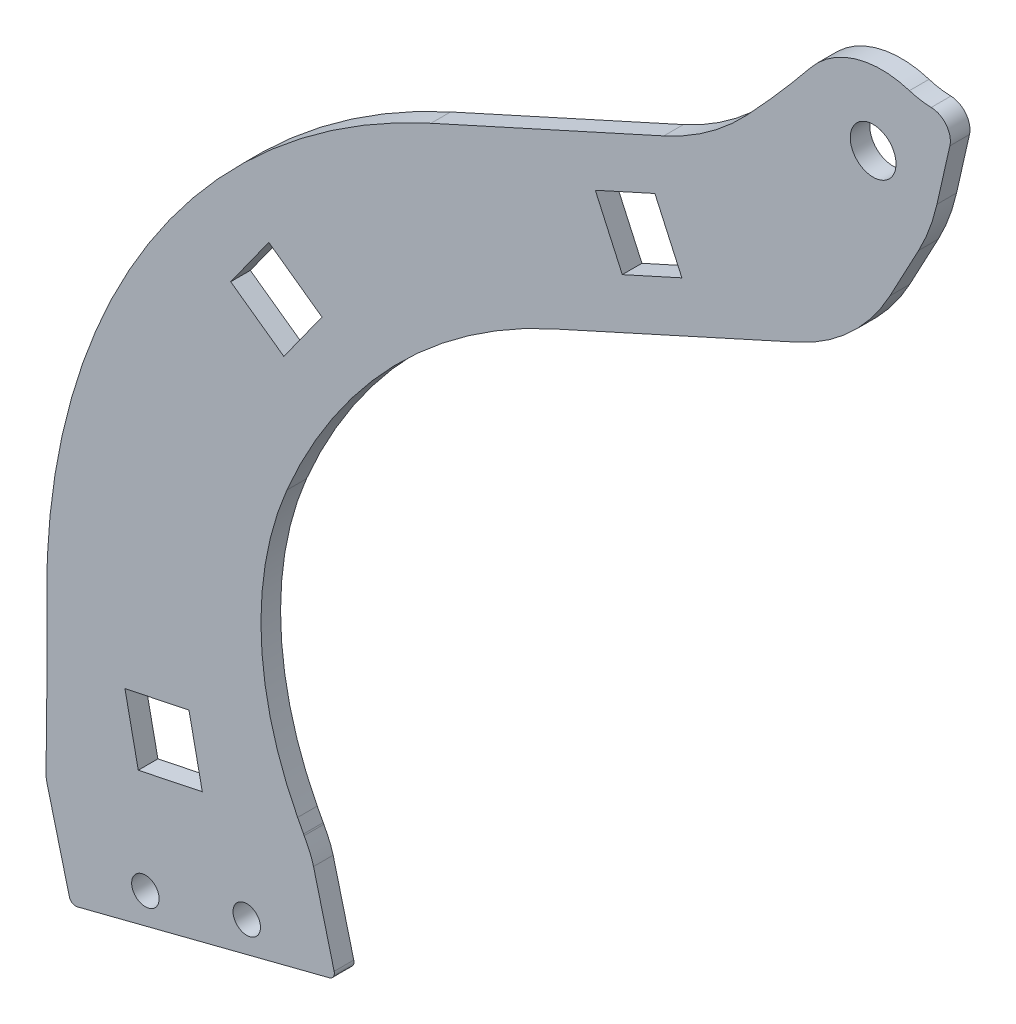
from build123d import *

# Parameters (mm, degrees)
SKETCH_1_R      = 2.1
SKETCH_1_R_2    = 3.5
EXTRUDE_2_DEPTH = 3


with BuildPart() as part:
    # 草图1 → 凸台-拉伸2 (new body)
    with BuildSketch(Plane.XY):
        with BuildLine():
            Line((60.108529062, 56.480111122), (64.487335669, 64.669737676))
            ThreePointArc((64.487335669, 64.669737676), (66.140949497, 68.333634007), (67.289887488, 72.185713512))
            Line((67.289887488, 72.185713512), (69.266744251, 80.910498231))
            ThreePointArc((69.266744251, 80.910498231), (68.708488356, 83.415866549), (66.417026795, 84.572466723))
            ThreePointArc((66.417026795, 84.572466723), (64.732022053, 84.734670443), (63.08660729, 85.132365403))
            ThreePointArc((63.08660729, 85.132365403), (54.829995833, 85.201744676), (47.970271321, 80.606026467))
            ThreePointArc((47.970271321, 80.606026467), (43.361470665, 75.124097666), (38.559351744, 69.810695675))
            Line((38.559351744, 69.810695675), (38.222405654, 69.45103511))
            ThreePointArc((38.222405654, 69.45103511), (32.32628292, 64.281621274), (25.53494992, 60.361812759))
            Line((25.53494992, 60.361812759), (-10.053418577, 44.242472458))
            ThreePointArc((-10.053418577, 44.242472458), (-53.239902616, 6.713533173), (-68.783230916, -48.349145956))
            ThreePointArc((-68.783230916, -48.349145956), (-68.739018938, -53.556339201), (-68.762598868, -58.763666747))
            Line((-68.762598868, -58.763666747), (-68.900791413, -71.283477095))
            add(Edge.make_bspline(
                [(-68.900791413, -71.283477095), (-68.904755434, -71.642604913), (-68.869353076, -71.99725933), (-68.78007525, -72.345791606)],
                knots=[0, 0, 0, 0, 1, 1, 1, 1], degree=3))
            Line((-68.78007525, -72.345791606), (-65.332232289, -85.805847824))
            add(Edge.make_bspline(
                [(-65.332232289, -85.805847824), (-65.266290033, -86.063280218), (-65.094030982, -86.28740051), (-64.753434981, -86.484972432), (-64.626638003, -86.528436786), (-64.365301889, -86.564062669), (-64.232742572, -86.556495641), (-64.104070986, -86.52353594)],
                knots=[0, 0, 0, 0, 0.5, 0.5, 0.75, 0.75, 1, 1, 1, 1], degree=3))
            Line((-64.104070986, -86.52353594), (-25.588649762, -76.657668977))
            add(Edge.make_bspline(
                [(-25.588649762, -76.657668977), (-25.460001904, -76.624715354), (-25.338581913, -76.566631903), (-25.128149885, -76.410642035), (-25.037269873, -76.310980591), (-24.901787172, -76.086443416), (-24.85605053, -75.960103889), (-24.81724118, -75.699526051), (-24.823808393, -75.566599434), (-24.856772712, -75.437909819)],
                knots=[0, 0, 0, 0, 0.25, 0.25, 0.5, 0.5, 0.75, 0.75, 1, 1, 1, 1], degree=3))
            Line((-24.856772712, -75.437909819), (-28.008350918, -63.134443476))
            add(Edge.make_bspline(
                [(-28.008350918, -63.134443476), (-28.161648764, -62.535983036), (-28.3702854, -61.960912506), (-28.867938385, -60.844745341), (-29.148955026, -60.300267489), (-29.435424134, -59.758094219)],
                knots=[0, 0, 0, 0, 0.5, 0.5, 1, 1, 1, 1], degree=3))
            ThreePointArc((-29.435424134, -59.758094219), (-29.482770246, -59.668648597), (-29.530246194, -59.579271823))
            add(Edge.make_bspline(
                [(-29.530246194, -59.579271823), (-29.836233344, -59.00420985), (-30.141588994, -58.428815067), (-30.441350493, -57.850472079)],
                knots=[0, 0, 0, 0, 1, 1, 1, 1], degree=3))
            ThreePointArc((-30.441350493, -57.850472079), (-36.012355657, -36.778090759), (-32.088860612, -15.337765675))
            ThreePointArc((-32.088860612, -15.337765675), (-15.685769973, 9.324890383), (8.566391241, 26.329027021))
            Line((8.566391241, 26.329027021), (46.030399371, 43.297916621))
            ThreePointArc((46.030399371, 43.297916621), (54.157658777, 48.726859562), (60.108529062, 56.480111122))
        make_face()
        with Locations((-53.71278904, -79.216483104)):
            Circle(SKETCH_1_R, mode=Mode.SUBTRACT)
        with Locations((-38.213210847, -75.246209079)):
            Circle(SKETCH_1_R, mode=Mode.SUBTRACT)
        with Locations((57.537099808, 74.395494602)):
            Circle(SKETCH_1_R_2, mode=Mode.SUBTRACT)
        Polygon((-56.839024332, -53.987565244), (-54.799481791, -63.777369442), (-45.009677593, -61.737826901), (-47.049220135, -51.948022703), align=None, mode=Mode.SUBTRACT)
        Polygon((-40.670972246, 7.953488017), (-32.543257763, 2.12766127), (-26.717431016, 10.255375753), (-34.845145499, 16.0812025), align=None, mode=Mode.SUBTRACT)
        Polygon((15.066954043, 47.935891978), (19.192847886, 38.826720775), (28.302019088, 42.952614619), (24.176125245, 52.061785821), align=None, mode=Mode.SUBTRACT)
    extrude(amount=EXTRUDE_2_DEPTH)


solid = part.part
